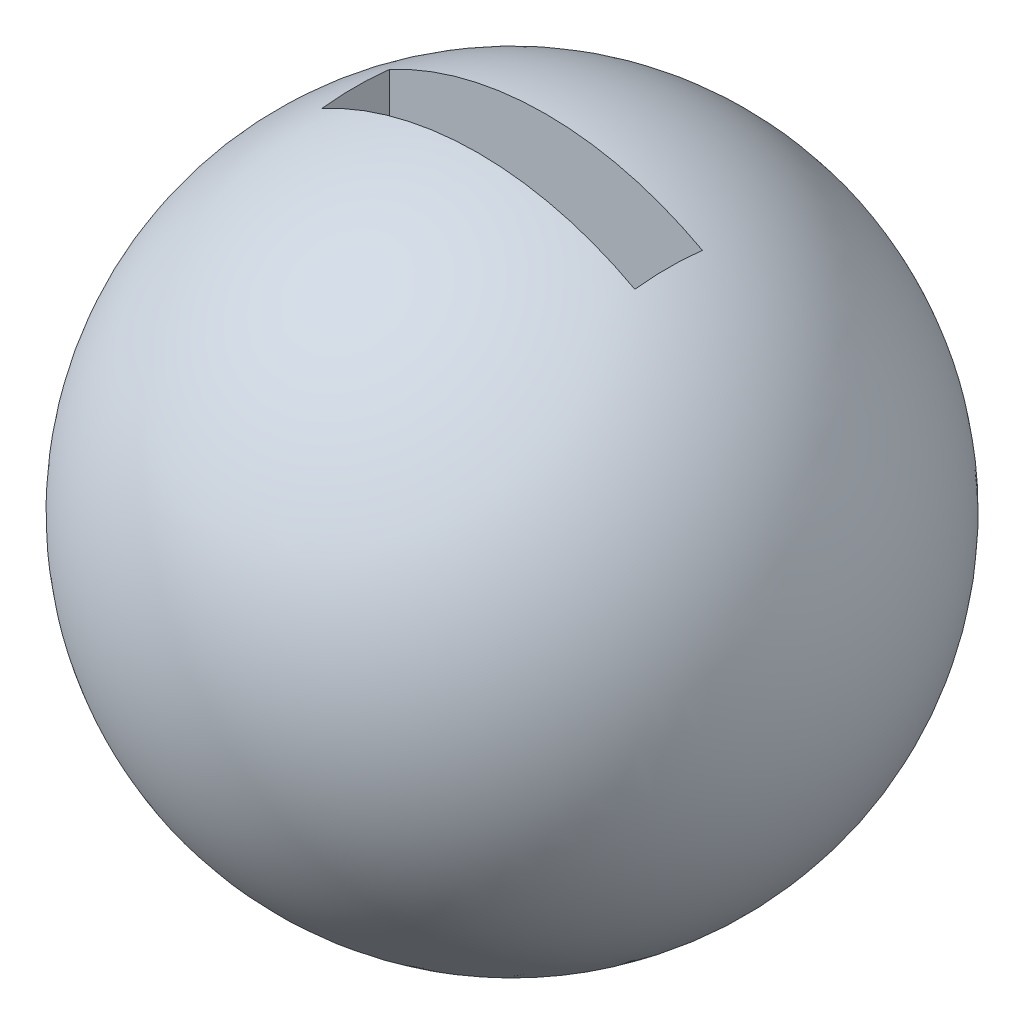
from build123d import *

# Parameters (mm, degrees)
SKETCH5_W               = 39.792677228
SKETCH5_H               = 2.74042188
CUT_EXTRUDE2_DEPTH      = 8.5
CUT_EXTRUDE3_REACH      = 20.594
CUT_EXTRUDE3_END_RADIUS = 10.735455277
SKETCH6_W               = 10.2
SKETCH6_H               = 2.2


with BuildPart() as part:
    # Sketch2 → Revolve1 (revolve)
    with BuildSketch(Plane(origin=(0, 0, 0), x_dir=(1, 0, 0), z_dir=(0, 1, 0))):
        with BuildLine():
            Line((0, -10.735455277), (0, 10.735455277))
            ThreePointArc((0, 10.735455277), (10.735455277, 0), (0, -10.735455277))
        make_face()
    revolve(axis=Axis((0, 0, 0), (0, 0, -1)))

    # Sketch5 → Cut-Extrude2 (cut, symmetric)
    with BuildSketch(Plane.XY):
        with Locations((0, -10.064678906)):
            Rectangle(SKETCH5_W, SKETCH5_H)
    extrude(amount=CUT_EXTRUDE2_DEPTH, both=True, mode=Mode.SUBTRACT)

    # Cut-Extrude3: up to this sphere (the profile starts inside it)
    cut_extrude3_end = Location((0, 0, 0)) * Sphere(CUT_EXTRUDE3_END_RADIUS, mode=Mode.PRIVATE)
    # Sketch6 → Cut-Extrude3 (cut, up to the surface)
    with BuildSketch(Plane(origin=(0, 0, 0), x_dir=(1, 0, 0), z_dir=(0, 1, 0)), mode=Mode.PRIVATE) as cut_extrude3_sk1:
        Rectangle(SKETCH6_W, SKETCH6_H)
    cut_extrude3_tool1 = extrude(cut_extrude3_sk1.sketch, amount=CUT_EXTRUDE3_REACH, mode=Mode.PRIVATE) & cut_extrude3_end
    add(cut_extrude3_tool1.solids().sort_by_distance((0, 0, 0))[0], mode=Mode.SUBTRACT)


solid = part.part
